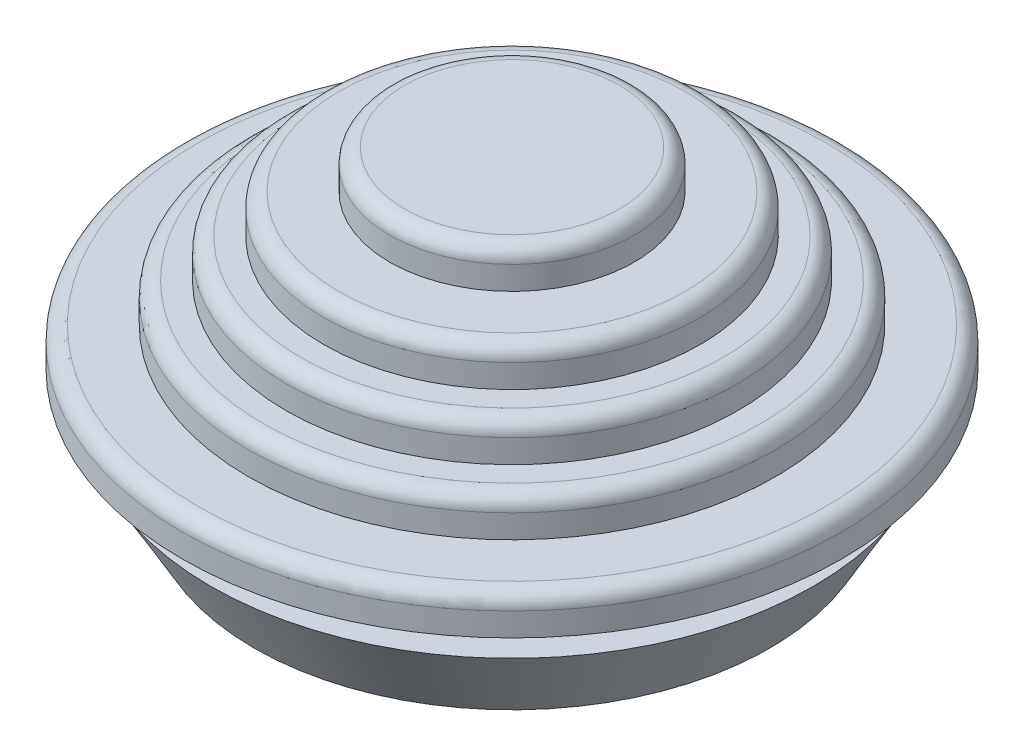
from build123d import *

# Parameters (mm, degrees)
FILLET1_R = 0.8


with BuildPart() as part:
    # Sketch1 → Revolve1 (revolve)
    with BuildSketch(Plane.XY, mode=Mode.PRIVATE) as revolve1_sk:
        Polygon((12.4, 0), (13.690598923, 0), (16, 4), (14.5, 4), (14.5, 6), (17.5, 6), (17.5, 8.04), (14, 8.04), (14, 10.08), (12, 10.08), (12, 12.12), (10, 12.12), (10, 14.16), (6.5, 14.16), (6.5, 16.2), (0, 16.2), (0, 12.16), (8, 12.16), (8, 10.12), (10, 10.12), (10, 8.08), (12.4, 8.08), align=None)
    revolve(revolve1_sk.sketch.rotate(Axis((0, 67.946967249, 0), (0, -1, 0)), 90), axis=Axis((0, 67.946967249, 0), (0, -1, 0)))

    # Fillet1
    fillet1_edges = [part.edges().sort_by_distance(p)[0] for p in [
        (0, 8.04, -17.5),
        (0, 10.08, -14),
        (0, 12.12, -12),
        (0, 14.16, -10),
        (0, 16.2, -6.5),
    ]]
    fillet(fillet1_edges, radius=FILLET1_R)


solid = part.part
